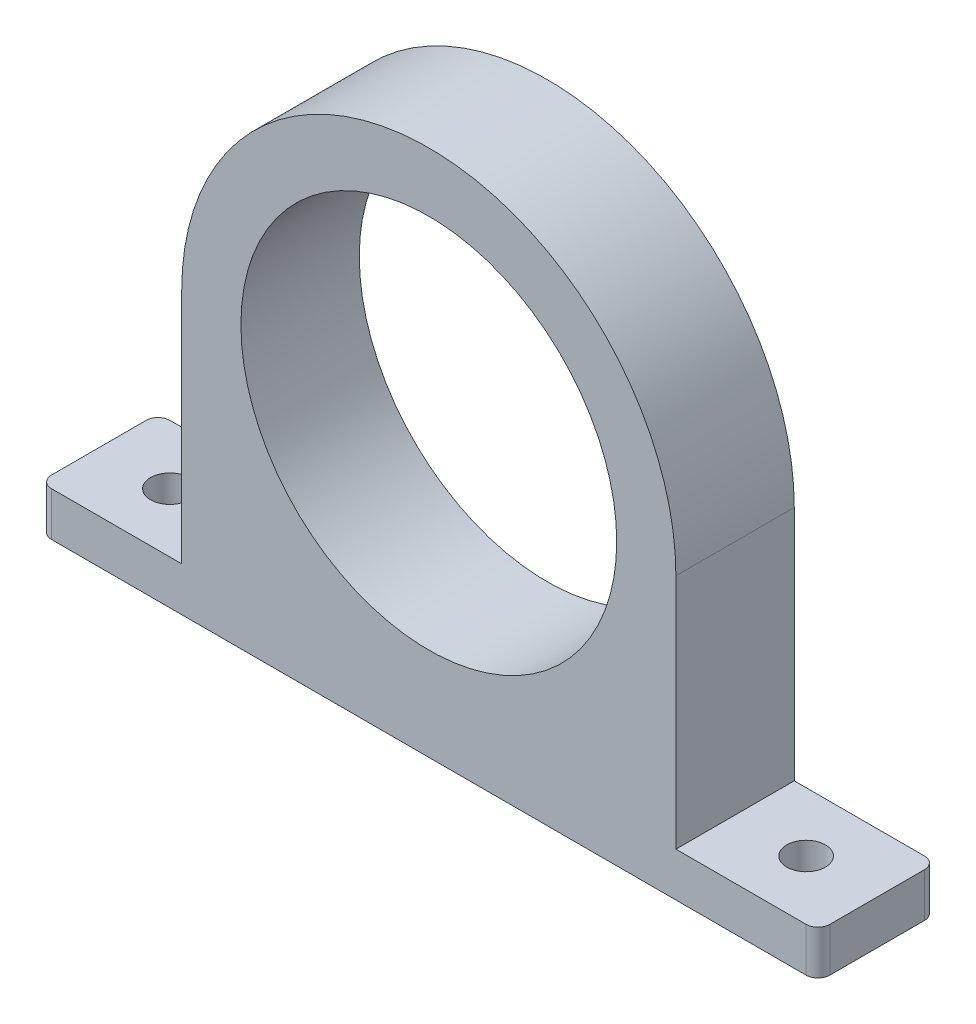
from build123d import *

# Parameters (mm, degrees)
SKETCH1_R             = 15.875
BOSS_EXTRUDE1_DEPTH   = 10
FILLET1_R             = 1
F_4_CLEARANCE_HOLE1_D = 3.2639


with BuildPart() as part:
    # Sketch1 → Boss-Extrude1 (new body)
    with BuildSketch(Plane.XY):
        with BuildLine():
            Line((-20.875, 0), (-20.875, -20))
            Line((-20.875, -20), (-32.875, -20))
            Line((-32.875, -20), (-32.875, -23.72))
            Line((-32.875, -23.72), (32.875, -23.72))
            Line((32.875, -23.72), (32.875, -20))
            Line((32.875, -20), (20.875, -20))
            Line((20.875, -20), (20.875, 0))
            ThreePointArc((20.875, 0), (0, 20.875), (-20.875, 0))
        make_face()
        Circle(SKETCH1_R, mode=Mode.SUBTRACT)
    extrude(amount=BOSS_EXTRUDE1_DEPTH)

    # Fillet1
    fillet1_edges = [part.edges().sort_by_distance(p)[0] for p in [
        (-32.875, -21.86, 10),
        (32.875, -21.86, 10),
        (32.875, -21.86, 0),
        (-32.875, -21.86, 0),
    ]]
    fillet(fillet1_edges, radius=FILLET1_R)

    # #4 Clearance Hole1 (through all)
    with Locations(Plane(origin=(0, -20, 0), x_dir=(1, 0, 0), z_dir=(0, 1, 0))):
        with Locations((-26.875, -5), (26.875, -5)):
            Hole(F_4_CLEARANCE_HOLE1_D / 2)


solid = part.part
